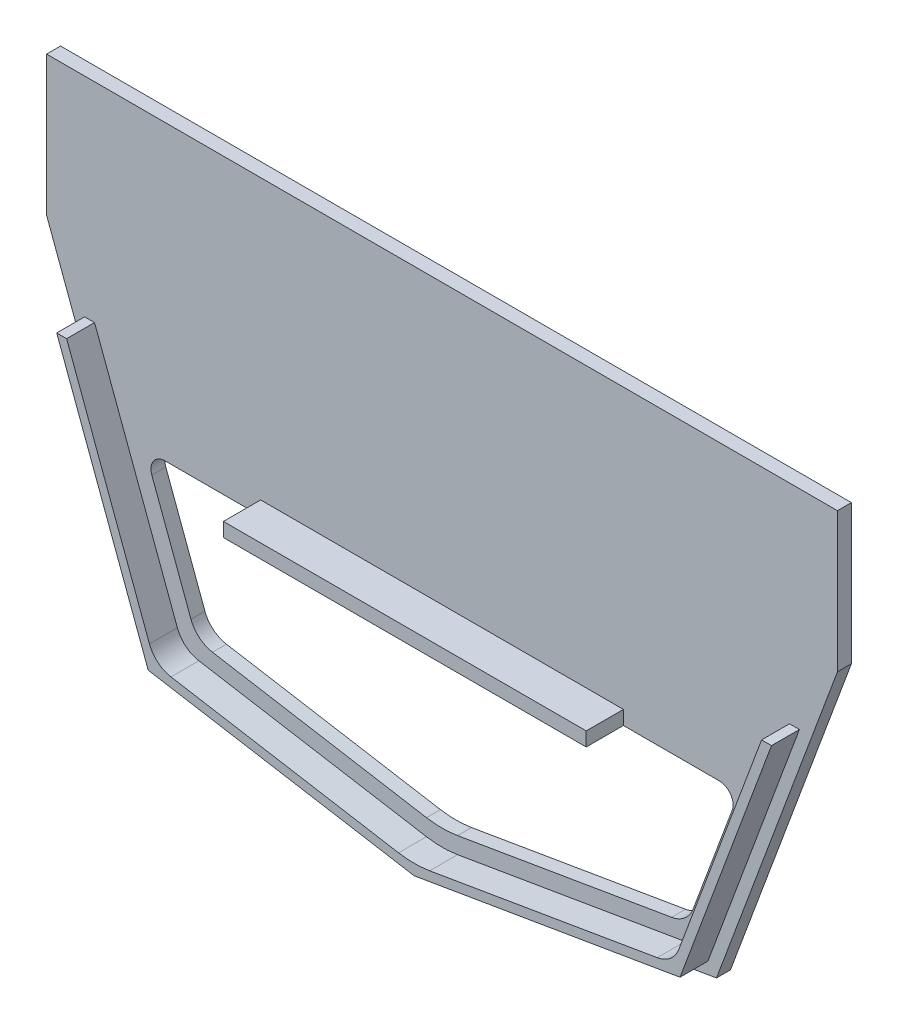
from build123d import *

# Parameters (mm, degrees)
BOSS_EXTRUDE1_DEPTH = 3
BOSS_EXTRUDE2_DEPTH = 6
FILLET1_R           = 20
FILLET2_R           = 6
FILLET4_R           = 3
SKETCH4_W           = 77.991272398
SKETCH4_H           = 3
BOSS_EXTRUDE3_DEPTH = 8


with BuildPart() as part:
    # Sketch2 → Boss-Extrude1 (new body)
    with BuildSketch(Plane.XY):
        Polygon((85, 0), (85, 30), (-85, 30), (-85, 0), (-58.995636199, -70), (0, -80), (58.995636199, -70), align=None)
        Polygon((63.885527266, -33), (52.762165892, -62.942485887), (0, -71.885887347), (-52.762165892, -62.942485887), (-63.885527266, -33), align=None, mode=Mode.SUBTRACT)
    extrude(amount=BOSS_EXTRUDE1_DEPTH)

    # Sketch3 → Boss-Extrude2 (add)
    with BuildSketch(Plane.XY.offset(3)):
        Polygon((-74.691839611, -14.825881059), (-55.682056872, -65.99747679), (0, -75.435811633), (55.682056872, -65.99747679), (74.691839611, -14.825881059), (76.82538642, -14.825881059), (57.154758795, -67.776375994), (0, -77.464339796), (-57.154758795, -67.776375994), (-76.82538642, -14.825881059), align=None)
    extrude(amount=BOSS_EXTRUDE2_DEPTH)

    # Fillet1
    fillet1_edges = [part.edges().sort_by_distance(p)[0] for p in [
        (0, -71.885887347, 1.5),
        (0, -75.435811633, 6),
    ]]
    fillet(fillet1_edges, radius=FILLET1_R)

    # Fillet2
    fillet2_edges = [part.edges().sort_by_distance(p)[0] for p in [
        (-52.762165892, -62.942485887, 1.5),
        (52.762165892, -62.942485887, 1.5),
        (55.682056872, -65.99747679, 6),
        (-55.682056872, -65.99747679, 6),
    ]]
    fillet(fillet2_edges, radius=FILLET2_R)

    # Fillet4
    fillet4_edges = [part.edges().sort_by_distance(p)[0] for p in [
        (63.885527266, -33, 1.5),
        (-63.885527266, -33, 1.5),
    ]]
    fillet(fillet4_edges, radius=FILLET4_R)

    # Sketch4 → Boss-Extrude3 (add)
    with BuildSketch(Plane.XY.offset(3)):
        with Locations((0, -31.5)):
            Rectangle(SKETCH4_W, SKETCH4_H)
    extrude(amount=BOSS_EXTRUDE3_DEPTH)


solid = part.part
